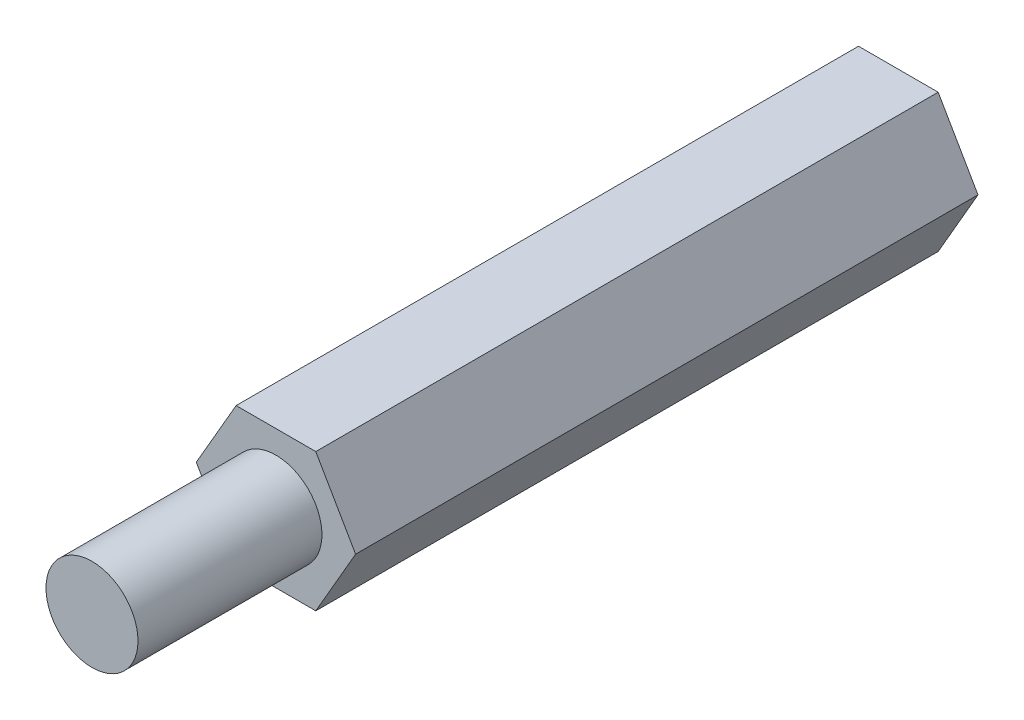
from build123d import *

# Parameters (mm, degrees)
SKETCH1_R           = 1.5
BOSS_EXTRUDE1_DEPTH = 6
BOSS_EXTRUDE2_DEPTH = 20.3
SKETCH3_R           = 1.5
CUT_EXTRUDE1_DEPTH  = 4.5


with BuildPart() as part:
    # Sketch1 → Boss-Extrude1 (new body)
    with BuildSketch(Plane.XY):
        Circle(SKETCH1_R)
    extrude(amount=BOSS_EXTRUDE1_DEPTH)

    # Sketch2 → Boss-Extrude2 (add)
    with BuildSketch(Plane(origin=(0, 0, 0), x_dir=(-1, 0, 0), z_dir=(0, 0, -1))):
        Polygon((-1.299038106, 2.25), (-2.598076211, 0), (-1.299038106, -2.25), (1.299038106, -2.25), (2.598076211, 0), (1.299038106, 2.25), align=None)
    extrude(amount=BOSS_EXTRUDE2_DEPTH)

    # Sketch3 → Cut-Extrude1 (cut)
    with BuildSketch(Plane(origin=(0, 0, -20.3), x_dir=(-1, 0, 0), z_dir=(0, 0, -1))):
        Circle(SKETCH3_R)
    extrude(amount=-CUT_EXTRUDE1_DEPTH, mode=Mode.SUBTRACT)


solid = part.part
